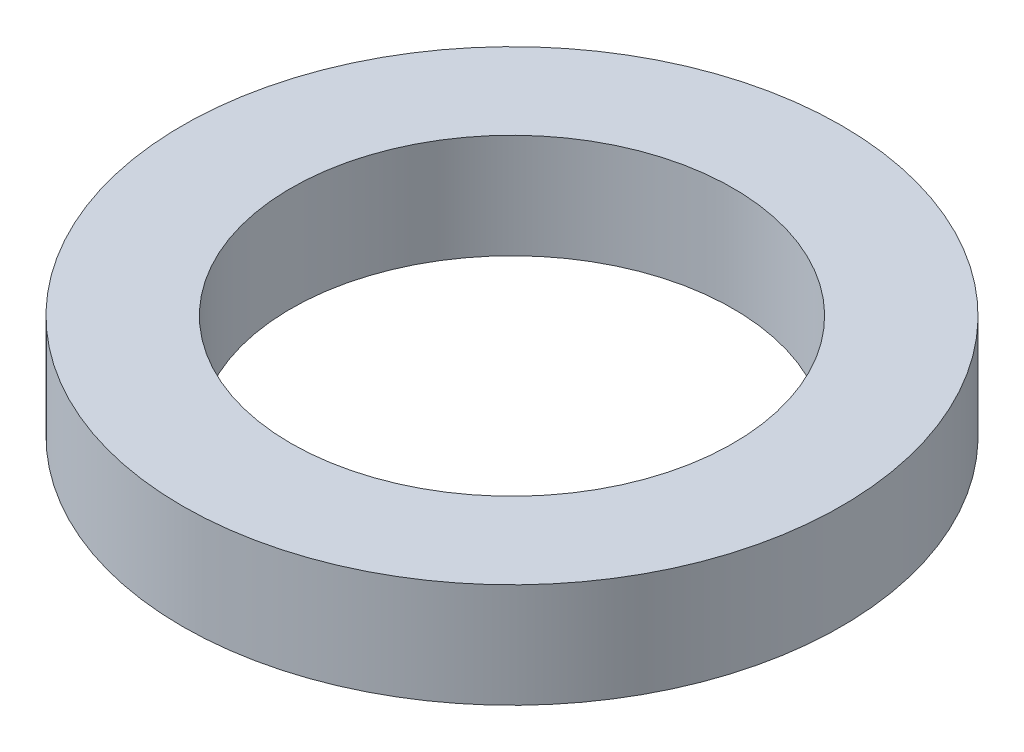
from build123d import *

# Parameters (mm, degrees)
ESQUISSE1_W = 1.975
ESQUISSE1_H = 1.9


with BuildPart() as part:
    # Esquisse1 → Révolution1 (revolve)
    with BuildSketch(Plane(origin=(0, 0, 0), x_dir=(-1, 0, 0), z_dir=(0, 0, -1)), mode=Mode.PRIVATE) as r_volution1_sk:
        with Locations((-5.0125, 0.95)):
            Rectangle(ESQUISSE1_W, ESQUISSE1_H)
    revolve(r_volution1_sk.sketch.rotate(Axis((0, 0, 0), (0, 1, 0)), 270), axis=Axis((0, 0, 0), (0, 1, 0)))


solid = part.part
